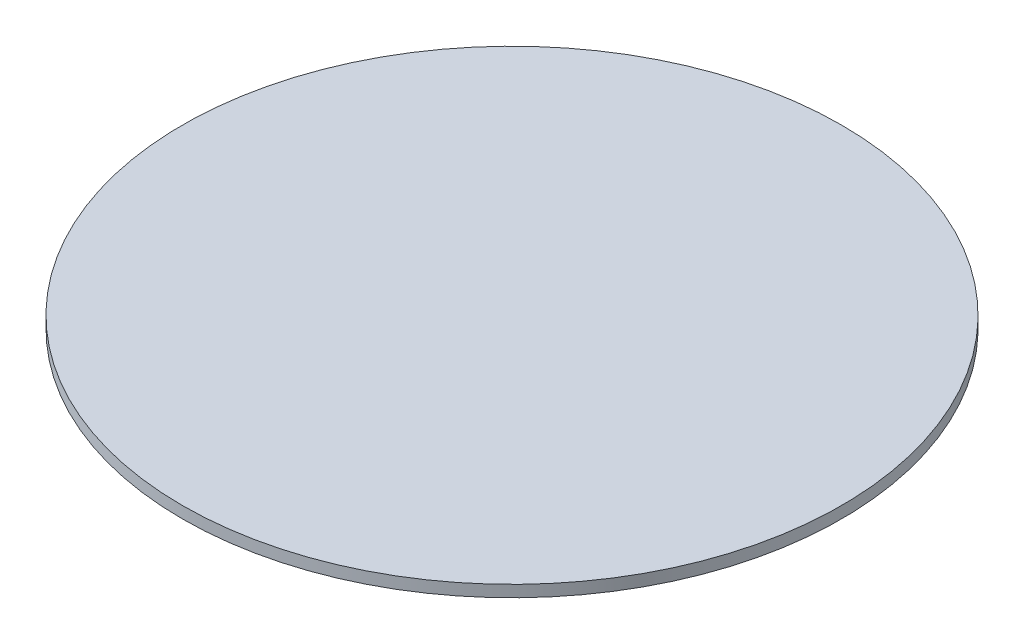
from build123d import *

# Parameters (mm, degrees)
SKETCH1_R           = 85
BOSS_EXTRUDE1_DEPTH = 3


with BuildPart() as part:
    # Sketch1 → Boss-Extrude1 (new body)
    with BuildSketch(Plane(origin=(0, 0, 0), x_dir=(1, 0, 0), z_dir=(0, 1, 0))):
        with Locations(Location((0, 0, 0), (0, 0, 270))):
            Circle(SKETCH1_R)
    extrude(amount=BOSS_EXTRUDE1_DEPTH)


solid = part.part
